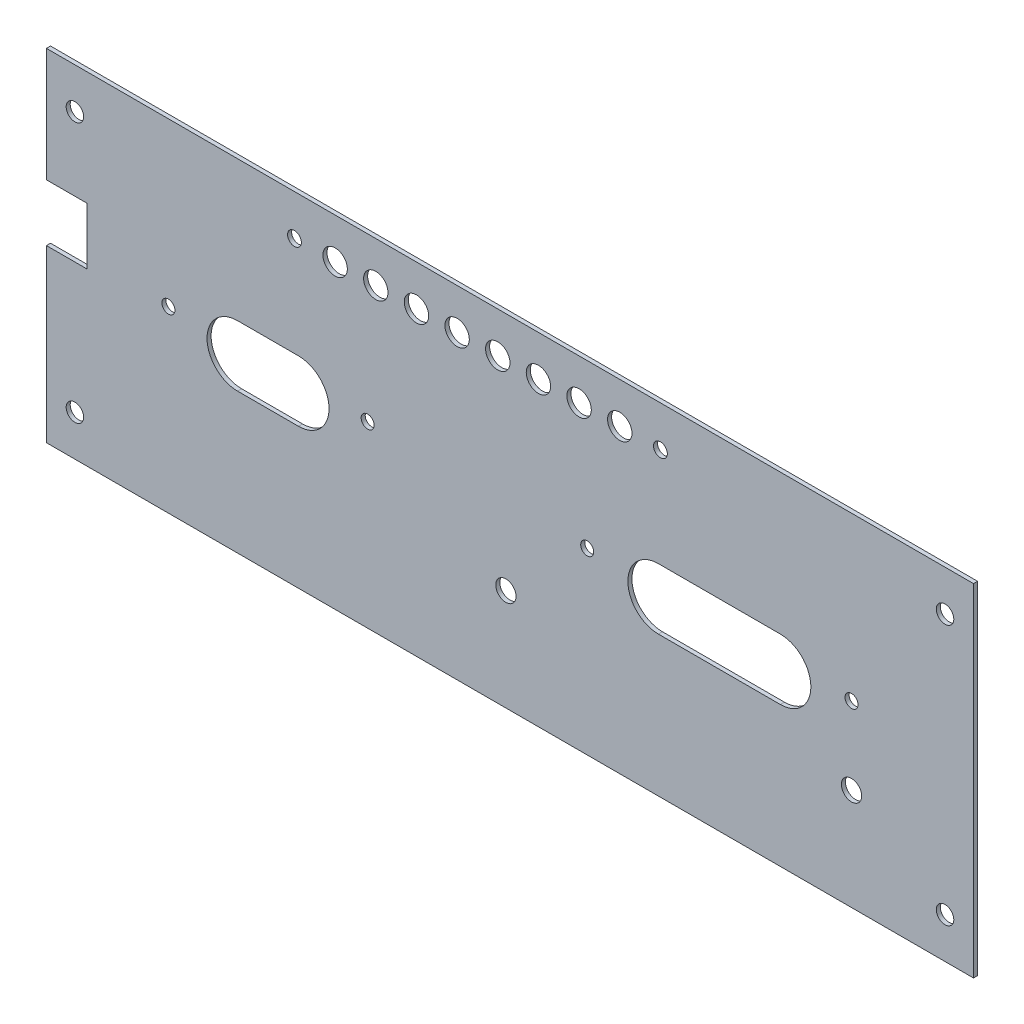
from build123d import *

# Parameters (mm, degrees)
SKETCH_1_W          = 228
SKETCH_1_H          = 84
SKETCH_1_R          = 2.15
EXTRUDE_1_DEPTH     = 1
SKETCH_4_R          = 1.6
SKETCH_4_W          = 14.464145402
SKETCH_4_H          = 14
CUT_EXTRUDE_2_DEPTH = 1
SKETCH_5_R          = 1.7
SKETCH_5_R_2        = 3
SKETCH_5_R_3        = 2.5
CUT_EXTRUDE_3_DEPTH = 10


with BuildPart() as part:
    # Эскиз1 → Вытянуть1 (new body)
    with BuildSketch(Plane.XY):
        Rectangle(SKETCH_1_W, SKETCH_1_H)
        with Locations((107, 32)):
            Circle(SKETCH_1_R, mode=Mode.SUBTRACT)
        with Locations(Location((-107, 32, 0), (0, 0, 180))):
            Circle(SKETCH_1_R, mode=Mode.SUBTRACT)
        with Locations((-107, -32)):
            Circle(SKETCH_1_R, mode=Mode.SUBTRACT)
        with Locations(Location((107, -32, 0), (0, 0, 180))):
            Circle(SKETCH_1_R, mode=Mode.SUBTRACT)
    extrude(amount=EXTRUDE_1_DEPTH)

    # Эскиз4 → Вырез-Вытянуть2 (cut)
    with BuildSketch(Plane.XY.offset(1)):
        with Locations((19, 2)):
            Circle(SKETCH_4_R)
        with Locations((84, 2)):
            Circle(SKETCH_4_R)
        with Locations((-84, 2)):
            Circle(SKETCH_4_R)
        with Locations((-35, 2)):
            Circle(SKETCH_4_R)
        with BuildLine():
            Line((36.5, 7.5), (66.5, 7.5))
            ThreePointArc((66.5, 7.5), (74, 0), (66.5, -7.5))
            Line((66.5, -7.5), (36.5, -7.5))
            ThreePointArc((36.5, -7.5), (29, 0), (36.5, 7.5))
        make_face()
        with BuildLine():
            Line((-67, 7.5), (-52, 7.5))
            ThreePointArc((-52, 7.5), (-44.5, 0), (-52, -7.5))
            Line((-52, -7.5), (-67, -7.5))
            ThreePointArc((-67, -7.5), (-74.5, 0), (-67, 7.5))
        make_face()
        with Locations((-111.232072701, 7)):
            Rectangle(SKETCH_4_W, SKETCH_4_H)
    extrude(amount=-CUT_EXTRUDE_2_DEPTH, mode=Mode.SUBTRACT)

    # Эскиз5 → Вырез-Вытянуть3 (cut)
    with BuildSketch(Plane.XY.offset(1)):
        with Locations((-53, 32)):
            Circle(SKETCH_5_R)
        with Locations((37, 32)):
            Circle(SKETCH_5_R)
        with Locations((-13, 32)):
            Circle(SKETCH_5_R_2)
        with Locations((-23, 32)):
            Circle(SKETCH_5_R_2)
        with Locations((-33, 32)):
            Circle(SKETCH_5_R_2)
        with Locations((-43, 32)):
            Circle(SKETCH_5_R_2)
        with Locations((-1, -17)):
            Circle(SKETCH_5_R_3)
        with Locations((84, -17)):
            Circle(SKETCH_5_R_3)
        with Locations(Location((-3, 32, 0), (0, 0, 180))):
            Circle(SKETCH_5_R_2)
        with Locations(Location((7, 32, 0), (0, 0, 180))):
            Circle(SKETCH_5_R_2)
        with Locations(Location((17, 32, 0), (0, 0, 180))):
            Circle(SKETCH_5_R_2)
        with Locations(Location((27, 32, 0), (0, 0, 180))):
            Circle(SKETCH_5_R_2)
    extrude(amount=-CUT_EXTRUDE_3_DEPTH, mode=Mode.SUBTRACT)


solid = part.part
